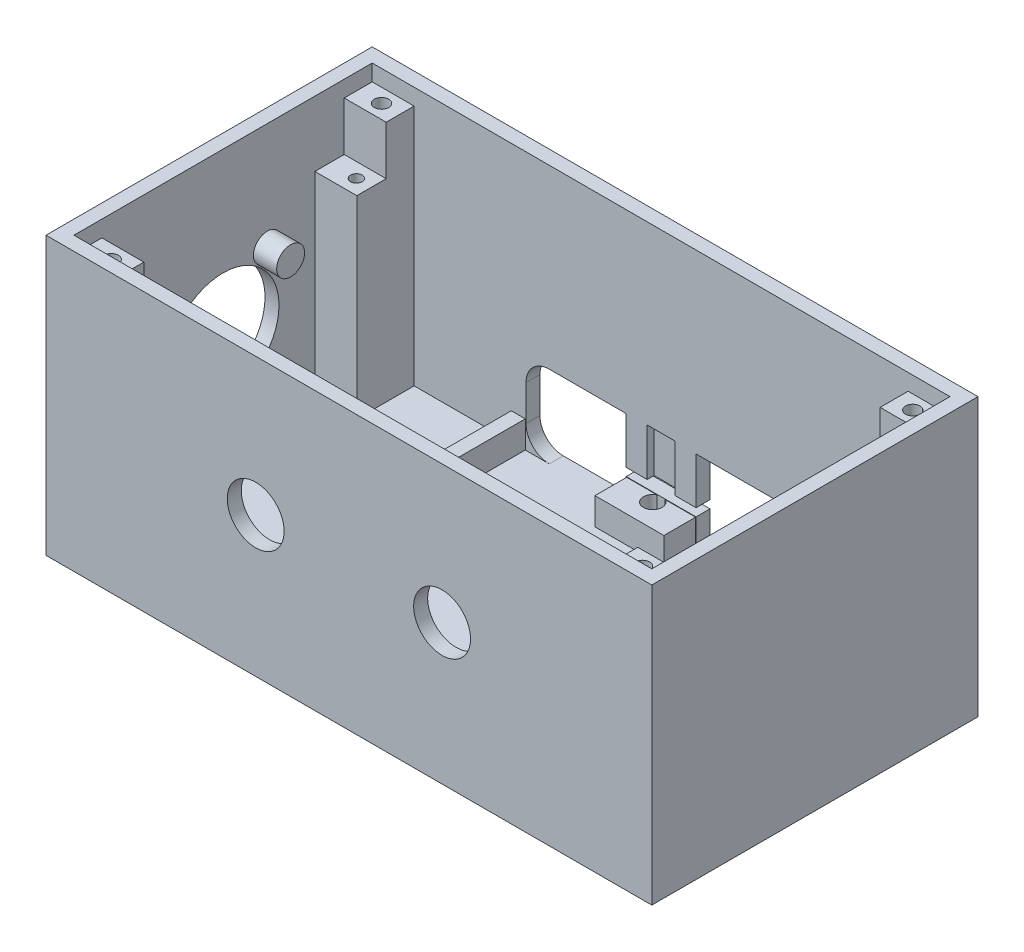
from build123d import *

# Parameters (mm, degrees)
SKETCH1_W       = 130
SKETCH1_H       = 70
EXTRUDE1_DEPTH  = 4
SKETCH2_W       = 130
SKETCH2_H       = 70
SKETCH2_W_2     = 124
SKETCH2_H_2     = 64
EXTRUDE2_DEPTH  = 55.5
SKETCH3_W       = 15
SKETCH3_H       = 1.7
EXTRUDE3_DEPTH  = 4.8
SKETCH4_W       = 3
SKETCH4_H       = 15
EXTRUDE5_DEPTH  = 5.8
SKETCH5_W       = 6
SKETCH5_H       = 10.139345217
EXTRUDE6_DEPTH  = 1.5
SKETCH22_R      = 3
EXTRUDE26_DEPTH = 8
SKETCH10_R      = 12
SKETCH10_R_2    = 1.5
EXTRUDE11_DEPTH = 6
EXTRUDE13_START = -3.5
SKETCH12_W      = 9
SKETCH12_H      = 6
EXTRUDE13_DEPTH = 52
EXTRUDE14_START = -3.5
SKETCH13_W      = 9
SKETCH13_H      = 6
EXTRUDE14_DEPTH = 52
SKETCH14_R      = 1.55
EXTRUDE15_DEPTH = 8
SKETCH20_R      = 1.55
EXTRUDE22_DEPTH = 8
SKETCH23_W      = 9
SKETCH23_H      = 6.3
EXTRUDE27_DEPTH = 41.5
SKETCH24_R      = 6.1
EXTRUDE28_DEPTH = 5
SKETCH25_R      = 1.25
EXTRUDE29_DEPTH = 8


with BuildPart() as part:
    # Sketch1 → Extrude1 (new body)
    with BuildSketch(Plane(origin=(0, 0, 0), x_dir=(1, 0, 0), z_dir=(0, 1, 0))):
        Rectangle(SKETCH1_W, SKETCH1_H)
    extrude(amount=EXTRUDE1_DEPTH)

    # Sketch2 → Extrude2 (add)
    with BuildSketch(Plane(origin=(0, 4, 0), x_dir=(1, 0, 0), z_dir=(0, 1, 0))):
        Rectangle(SKETCH2_W, SKETCH2_H)
        Rectangle(SKETCH2_W_2, SKETCH2_H_2, mode=Mode.SUBTRACT)
    extrude(amount=EXTRUDE2_DEPTH)

    # Sketch3 → Extrude3 (cut)
    with BuildSketch(Plane(origin=(0, 0, -35), x_dir=(-1, 0, 0), z_dir=(0, 0, -1))):
        with BuildLine():
            Line((-24, 21.6), (-7.5, 21.6))
            Line((-7.5, 21.6), (-7.5, 4))
            Line((-7.5, 4), (-24, 4))
            ThreePointArc((-24, 4), (-27.535533906, 5.464466094), (-29, 9))
            Line((-29, 9), (-29, 16.6))
            ThreePointArc((-29, 16.6), (-27.535533906, 20.135533906), (-24, 21.6))
        make_face()
        with BuildLine():
            Line((7.5, 4), (24, 4))
            ThreePointArc((24, 4), (27.535533906, 5.464466094), (29, 9))
            Line((29, 9), (29, 16.6))
            ThreePointArc((29, 16.6), (27.535533906, 20.135533906), (24, 21.6))
            Line((24, 21.6), (7.5, 21.6))
            Line((7.5, 21.6), (7.5, 4))
        make_face()
        with Locations((0, 10.75)):
            Rectangle(SKETCH3_W, SKETCH3_H)
    extrude(amount=-EXTRUDE3_DEPTH, mode=Mode.SUBTRACT)

    # Sketch4 → Extrude5 (add)
    with BuildSketch(Plane(origin=(0, 4, 0), x_dir=(1, 0, 0), z_dir=(0, 1, 0))):
        with BuildLine():
            Line((-0.871779789, 32), (-7.4, 32))
            Line((-7.4, 32), (-7.4, 25.2))
            Line((-7.4, 25.2), (7.4, 25.2))
            Line((7.4, 25.2), (7.4, 32))
            Line((7.4, 32), (0.871779789, 32))
            ThreePointArc((0.871779789, 32), (1.694632641, 31.262177109), (2, 30.2))
            ThreePointArc((2, 30.2), (-1.062177109, 28.505367359), (-0.871779789, 32))
        make_face()
        with Locations((-30.65, 24.5)):
            Rectangle(SKETCH4_W, SKETCH4_H)
        with Locations((30.65, 24.5)):
            Rectangle(SKETCH4_W, SKETCH4_H)
    extrude(amount=EXTRUDE5_DEPTH)

    # Sketch5 → Extrude6 (cut)
    with BuildSketch(Plane.XY.offset(-32)):
        with Locations((0, 16.669672609)):
            Rectangle(SKETCH5_W, SKETCH5_H)
    extrude(amount=-EXTRUDE6_DEPTH, mode=Mode.SUBTRACT)

    # Sketch22 → Extrude26 (add)
    with BuildSketch(Plane.ZY.offset(65)):
        with Locations((-9.5, 36.5)):
            Circle(SKETCH22_R)
        with Locations((9.5, 12.5)):
            Circle(SKETCH22_R)
    extrude(amount=-EXTRUDE26_DEPTH)

    # Sketch10 → Extrude11 (cut)
    with BuildSketch(Plane.ZY.offset(65)):
        with Locations((0, 24.5)):
            Circle(SKETCH10_R)
        with Locations((-9.5, 36.5)):
            Circle(SKETCH10_R_2)
        with Locations((9.5, 12.5)):
            Circle(SKETCH10_R_2)
    extrude(amount=-EXTRUDE11_DEPTH, mode=Mode.SUBTRACT)

    # Sketch12 → Extrude13 (add)
    with BuildSketch(Plane(origin=(0, 59.5, 0), x_dir=(1, 0, 0), z_dir=(0, 1, 0)).offset(EXTRUDE13_START)):
        with Locations((-57.5, -29)):
            Rectangle(SKETCH12_W, SKETCH12_H)
        with Locations((57.5, -29)):
            Rectangle(SKETCH12_W, SKETCH12_H)
    extrude(amount=-EXTRUDE13_DEPTH)

    # Sketch13 → Extrude14 (add)
    with BuildSketch(Plane(origin=(0, 59.5, 0), x_dir=(1, 0, 0), z_dir=(0, 1, 0)).offset(EXTRUDE14_START)):
        with Locations((-57.5, 29)):
            Rectangle(SKETCH13_W, SKETCH13_H)
        with Locations((57.5, 29)):
            Rectangle(SKETCH13_W, SKETCH13_H)
    extrude(amount=-EXTRUDE14_DEPTH)

    # Sketch14 → Extrude15 (cut)
    with BuildSketch(Plane(origin=(0, 59.5, 0), x_dir=(1, 0, 0), z_dir=(0, 1, 0))):
        with Locations(Location((-57, 29, 0), (0, 0, 270))):
            Circle(SKETCH14_R)
        with Locations(Location((57, 29, 0), (0, 0, 270))):
            Circle(SKETCH14_R)
    extrude(amount=-EXTRUDE15_DEPTH, mode=Mode.SUBTRACT)

    # Sketch20 → Extrude22 (cut)
    with BuildSketch(Plane(origin=(0, 59.5, 0), x_dir=(1, 0, 0), z_dir=(0, 1, 0))):
        with Locations(Location((-57, -29, 0), (0, 0, 270))):
            Circle(SKETCH20_R)
        with Locations(Location((57, -29, 0), (0, 0, 270))):
            Circle(SKETCH20_R)
    extrude(amount=-EXTRUDE22_DEPTH, mode=Mode.SUBTRACT)

    # Sketch23 → Extrude27 (add)
    with BuildSketch(Plane(origin=(0, 4, 0), x_dir=(1, 0, 0), z_dir=(0, 1, 0))):
        with Locations((-57.5, 22.85)):
            Rectangle(SKETCH23_W, SKETCH23_H)
        with Locations((-57.5, -22.85)):
            Rectangle(SKETCH23_W, SKETCH23_H)
        with Locations((57.5, -22.85)):
            Rectangle(SKETCH23_W, SKETCH23_H)
        with Locations((57.5, 22.85)):
            Rectangle(SKETCH23_W, SKETCH23_H)
    extrude(amount=EXTRUDE27_DEPTH)

    # Sketch24 → Extrude28 (cut)
    with BuildSketch(Plane.XY.offset(35)):
        with Locations((-20, 30)):
            Circle(SKETCH24_R)
        with Locations((20, 30)):
            Circle(SKETCH24_R)
    extrude(amount=-EXTRUDE28_DEPTH, mode=Mode.SUBTRACT)

    # Sketch25 → Extrude29 (cut)
    with BuildSketch(Plane(origin=(0, 45.5, 0), x_dir=(1, 0, 0), z_dir=(0, 1, 0))):
        with Locations(Location((-56.25, 22.86, 0), (0, 0, 270))):
            Circle(SKETCH25_R)
        with Locations(Location((56.25, 22.86, 0), (0, 0, 270))):
            Circle(SKETCH25_R)
        with Locations(Location((-56.25, -22.86, 0), (0, 0, 270))):
            Circle(SKETCH25_R)
        with Locations(Location((56.25, -22.86, 0), (0, 0, 270))):
            Circle(SKETCH25_R)
    extrude(amount=-EXTRUDE29_DEPTH, mode=Mode.SUBTRACT)


solid = part.part
